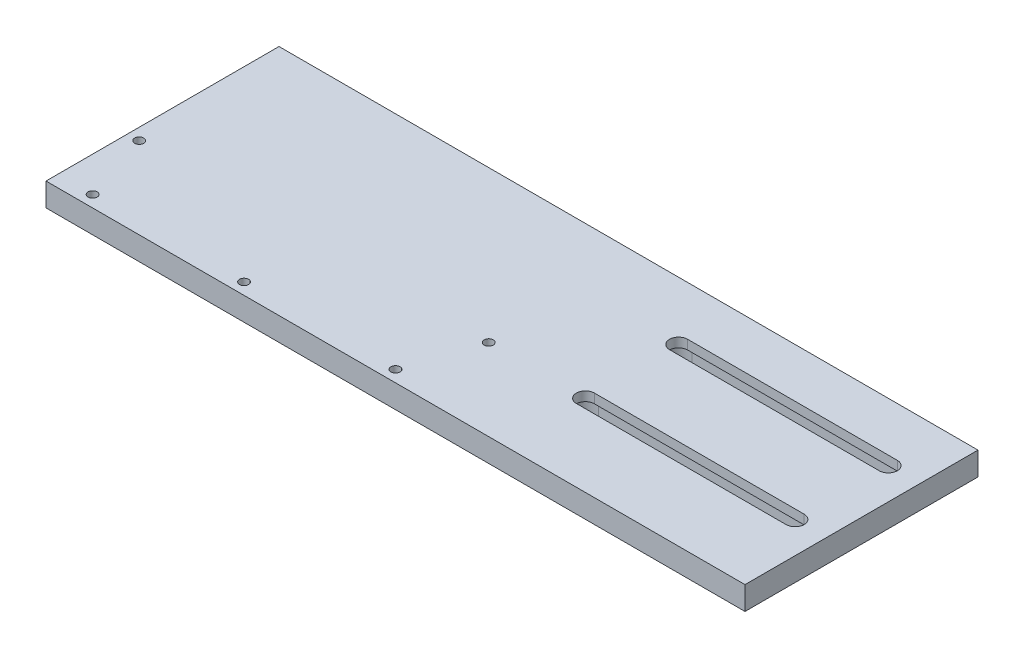
from build123d import *

# Parameters (mm, degrees)
SKETCH2_W                                          = 381
SKETCH2_H                                          = 127
BOSS_EXTRUDE1_DEPTH                                = 12.7
CUT_EXTRUDE1_DEPTH                                 = 12.7
CSK_FOR_10_FLAT_HEAD_MACHINE_SCREW_100_D           = 4.9784
CSK_FOR_10_FLAT_HEAD_MACHINE_SCREW_100_CSINK_D     = 9.779
CSK_FOR_10_FLAT_HEAD_MACHINE_SCREW_100_CSINK_ANGLE = 100
CSK_FOR_10_FLAT_HEAD_MACHINE_SCREW_2_D             = 4.9784
CSK_FOR_10_FLAT_HEAD_MACHINE_SCREW_2_CSINK_D       = 9.779
CSK_FOR_10_FLAT_HEAD_MACHINE_SCREW_2_CSINK_ANGLE   = 100
CUT_EXTRUDE3_DEPTH                                 = 7.62


with BuildPart() as part:
    # Sketch2 → Boss-Extrude1 (new body)
    with BuildSketch(Plane(origin=(0, 0, 0), x_dir=(1, 0, 0), z_dir=(0, 1, 0))):
        Rectangle(SKETCH2_W, SKETCH2_H)
    extrude(amount=BOSS_EXTRUDE1_DEPTH)

    # Sketch8 → Cut-Extrude1 (cut)
    with BuildSketch(Plane.XZ):
        with BuildLine():
            Line((59.055, 23.9776), (173.355, 23.9776))
            ThreePointArc((173.355, 23.9776), (178.2826, 19.05), (173.355, 14.1224))
            Line((173.355, 14.1224), (59.055, 14.1224))
            ThreePointArc((59.055, 14.1224), (54.1274, 19.05), (59.055, 23.9776))
        make_face()
        with BuildLine():
            Line((59.055, -26.8224), (173.355, -26.8224))
            ThreePointArc((173.355, -26.8224), (178.2826, -31.75), (173.355, -36.6776))
            Line((173.355, -36.6776), (59.055, -36.6776))
            ThreePointArc((59.055, -36.6776), (54.1274, -31.75), (59.055, -26.8224))
        make_face()
    extrude(amount=-CUT_EXTRUDE1_DEPTH, mode=Mode.SUBTRACT)

    # CSK for _10 Flat Head Machine Screw _100 (through all)
    with Locations(Plane(origin=(0, 0, 0), x_dir=(-1, 0, 0), z_dir=(0, -1, 0))):
        with Locations((171.45, -57.15), (88.9, -57.15), (6.35, -57.15)):
            CounterSinkHole(CSK_FOR_10_FLAT_HEAD_MACHINE_SCREW_100_D / 2, CSK_FOR_10_FLAT_HEAD_MACHINE_SCREW_100_CSINK_D / 2, counter_sink_angle=CSK_FOR_10_FLAT_HEAD_MACHINE_SCREW_100_CSINK_ANGLE)

    # CSK for _10 Flat Head Machine Screw  2 (through all)
    with Locations(Plane(origin=(0, 0, 0), x_dir=(-1, 0, 0), z_dir=(0, -1, 0))):
        with Locations((184.15, -19.05), (-6.35, -19.05)):
            CounterSinkHole(CSK_FOR_10_FLAT_HEAD_MACHINE_SCREW_2_D / 2, CSK_FOR_10_FLAT_HEAD_MACHINE_SCREW_2_CSINK_D / 2, counter_sink_angle=CSK_FOR_10_FLAT_HEAD_MACHINE_SCREW_2_CSINK_ANGLE)

    # Sketch16 → Cut-Extrude3 (cut)
    with BuildSketch(Plane.XZ):
        with BuildLine():
            Line((59.055, 26.289), (173.355, 26.289))
            ThreePointArc((173.355, 26.289), (180.594, 19.05), (173.355, 11.811))
            Line((173.355, 11.811), (59.055, 11.811))
            ThreePointArc((59.055, 11.811), (51.816, 19.05), (59.055, 26.289))
        make_face()
        with BuildLine():
            Line((59.055, -24.511), (173.355, -24.511))
            ThreePointArc((173.355, -24.511), (180.594, -31.75), (173.355, -38.989))
            Line((173.355, -38.989), (59.055, -38.989))
            ThreePointArc((59.055, -38.989), (51.816, -31.75), (59.055, -24.511))
        make_face()
    extrude(amount=-CUT_EXTRUDE3_DEPTH, mode=Mode.SUBTRACT)


solid = part.part
